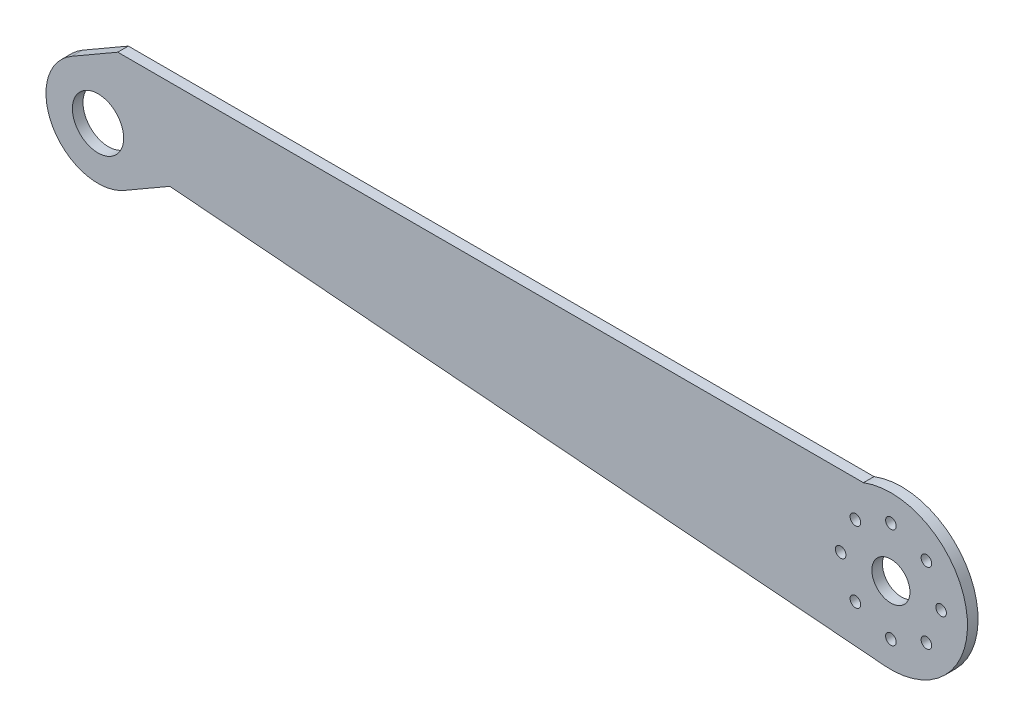
from build123d import *

# Parameters (mm, degrees)
SKETCH_1_R      = 9.7
SKETCH_1_R_2    = 7.2
SKETCH_1_R_3    = 2
EXTRUDE_1_DEPTH = 4


with BuildPart() as part:
    # 草图1 → 凸台-拉伸1 (new body)
    with BuildSketch(Plane.XY):
        with BuildLine():
            Line((-9.85, 17.060700455), (7.470508076, 27.060700455))
            Line((7.470508076, 27.060700455), (289.624667154, 27.060700455))
            ThreePointArc((289.624667154, 27.060700455), (328.694852344, 4.11311011), (297.66555963, -28.905888469))
            Line((297.66555963, -28.905888469), (27.170508076, -7.060700455))
            Line((27.170508076, -7.060700455), (9.85, -17.060700455))
            ThreePointArc((9.85, -17.060700455), (-17.060700455, -9.85), (-9.85, 17.060700455))
        make_face()
        Circle(SKETCH_1_R, mode=Mode.SUBTRACT)
        with Locations((300, 0)):
            Circle(SKETCH_1_R_2, mode=Mode.SUBTRACT)
        with Locations((319, 0)):
            Circle(SKETCH_1_R_3, mode=Mode.SUBTRACT)
        with Locations((313.435028843, -13.435028843)):
            Circle(SKETCH_1_R_3, mode=Mode.SUBTRACT)
        with Locations((300, -19)):
            Circle(SKETCH_1_R_3, mode=Mode.SUBTRACT)
        with Locations((286.564971157, -13.435028843)):
            Circle(SKETCH_1_R_3, mode=Mode.SUBTRACT)
        with Locations((281, 0)):
            Circle(SKETCH_1_R_3, mode=Mode.SUBTRACT)
        with Locations((286.564971157, 13.435028843)):
            Circle(SKETCH_1_R_3, mode=Mode.SUBTRACT)
        with Locations((300, 19)):
            Circle(SKETCH_1_R_3, mode=Mode.SUBTRACT)
        with Locations((313.435028843, 13.435028843)):
            Circle(SKETCH_1_R_3, mode=Mode.SUBTRACT)
    extrude(amount=EXTRUDE_1_DEPTH)


solid = part.part
